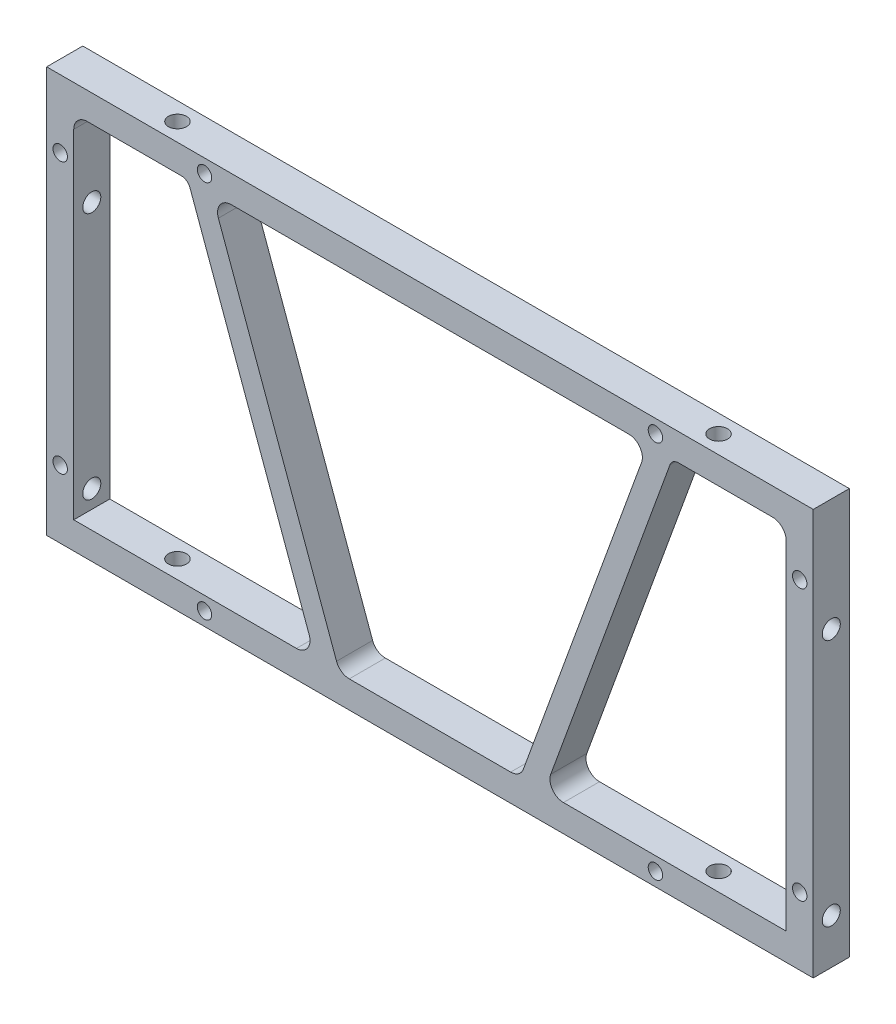
from build123d import *

# Parameters (mm, degrees)
SKETCH_1_W               = 170
SKETCH_1_H               = 90
SKETCH_1_W_2             = 158
SKETCH_1_H_2             = 78
EXTRUDE_1_DEPTH          = 8
SKETCH_2_R               = 2
CUT_EXTRUDE_1_DEPTH      = 177.036927944
SKETCH_3_R               = 2
CUT_EXTRUDE_2_DEPTH      = 125.05240828
CUT_EXTRUDE_3_DEPTH      = 97.509066932
CUT_EXTRUDE_3_DEPTH_BACK = 97.509066932
SKETCH_4_R               = 1.6
EXTRUDE_2_DEPTH          = 8
FILLET_2_R               = 3
FILLET_3_R               = 2


with BuildPart() as part:
    # 草图1 → 凸台-拉伸1 (new body)
    with BuildSketch(Plane.XY):
        Rectangle(SKETCH_1_W, SKETCH_1_H)
        Rectangle(SKETCH_1_W_2, SKETCH_1_H_2, mode=Mode.SUBTRACT)
    extrude(amount=EXTRUDE_1_DEPTH)

    # 草图2 → 切除-拉伸1 (cut, through all)
    with BuildSketch(Plane.ZY.offset(85)):
        with Locations((4, 20)):
            Circle(SKETCH_2_R)
        with Locations((4, -35)):
            Circle(SKETCH_2_R)
    extrude(amount=-CUT_EXTRUDE_1_DEPTH, mode=Mode.SUBTRACT)

    # 草图3 → 切除-拉伸2 (cut, through all)
    with BuildSketch(Plane(origin=(0, 45, 0), x_dir=(1, 0, 0), z_dir=(0, 1, 0))):
        with Locations(Location((-60, -4, 0), (0, 0, 270))):
            Circle(SKETCH_3_R)
        with Locations(Location((60, -4, 0), (0, 0, 270))):
            Circle(SKETCH_3_R)
    extrude(amount=-CUT_EXTRUDE_2_DEPTH, mode=Mode.SUBTRACT)

    # 草图4 → 切除-拉伸3 (cut, two sides: drawn at the far end of the back side and taken through both)
    with BuildSketch(Plane(origin=(0, 0, 0), x_dir=(-1, 0, 0), z_dir=(0, 0, -1)).offset(-CUT_EXTRUDE_3_DEPTH_BACK)):
        with Locations((-82, 30)):
            Circle(SKETCH_4_R)
        with Locations((-82, -30)):
            Circle(SKETCH_4_R)
        with Locations((82, 30)):
            Circle(SKETCH_4_R)
        with Locations((82, -30)):
            Circle(SKETCH_4_R)
        with Locations((-50, 42)):
            Circle(SKETCH_4_R)
        with Locations((50, 42)):
            Circle(SKETCH_4_R)
        with Locations((-50, -42)):
            Circle(SKETCH_4_R)
        with Locations((50, -42)):
            Circle(SKETCH_4_R)
    extrude(amount=CUT_EXTRUDE_3_DEPTH + CUT_EXTRUDE_3_DEPTH_BACK, mode=Mode.SUBTRACT)

    # 草图5 → 凸台-拉伸2 (add)
    with BuildSketch(Plane(origin=(0, 0, 0), x_dir=(-1, 0, 0), z_dir=(0, 0, -1))):
        Polygon((-53.710567135, 39), (-25.320888862, -39), (-20, -39), (-48.389678273, 39), align=None)
        Polygon((53.710567135, 39), (48.389678273, 39), (20, -39), (25.320888862, -39), align=None)
    extrude(amount=-EXTRUDE_2_DEPTH)

    # 圆角2
    fillet_2_edges = [part.edges().sort_by_distance(p)[0] for p in [
        (25.320888862, -39, 4),
        (20, -39, 4),
        (48.389678273, 39, 4),
        (-48.389678273, 39, 4),
        (-20, -39, 4),
        (-25.320888862, -39, 4),
        (79, 39, 4),
        (-79, 39, 4),
    ]]
    fillet(fillet_2_edges, radius=FILLET_2_R)

    # 圆角3
    fillet_3_edges = [part.edges().sort_by_distance(p)[0] for p in [
        (53.710567135, 39, 4),
        (-53.710567135, 39, 4),
    ]]
    fillet(fillet_3_edges, radius=FILLET_3_R)


solid = part.part
